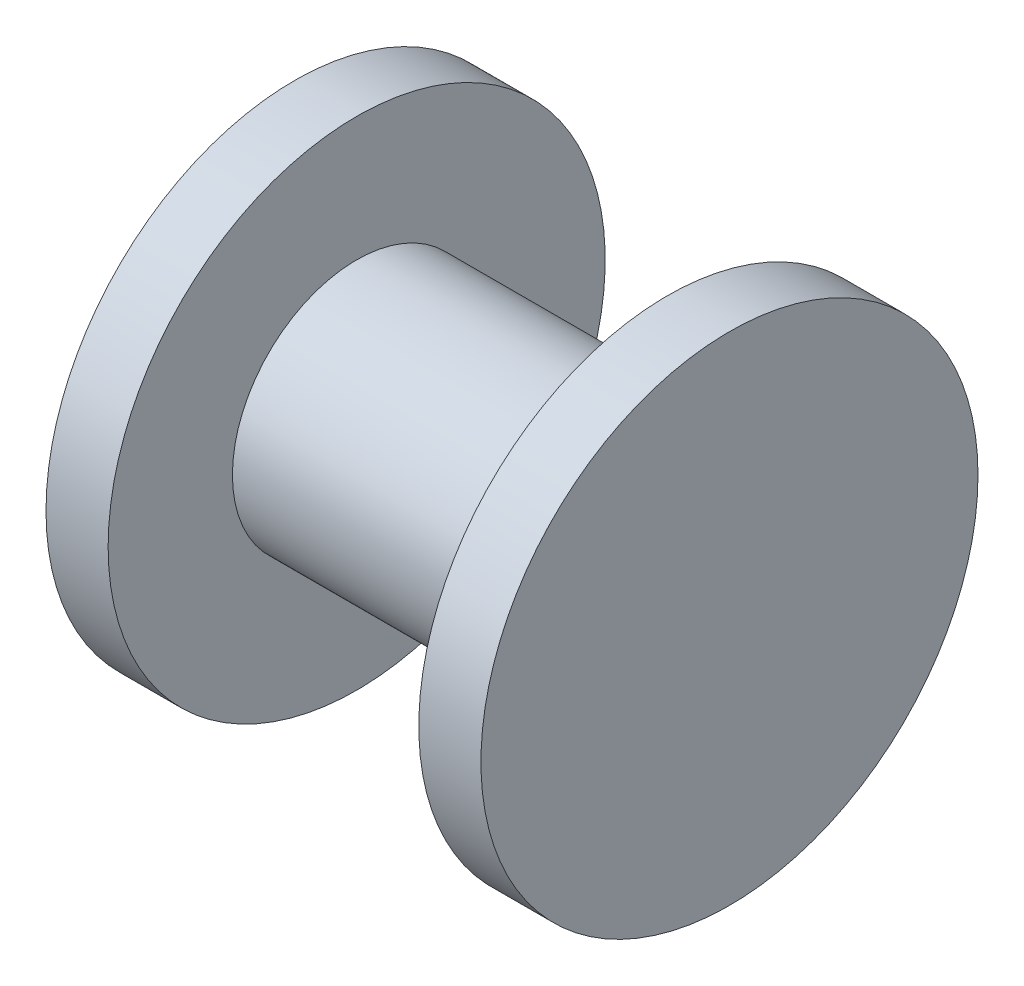
from build123d import *

# Parameters (mm, degrees)
SKETCH1_W           = 25
SKETCH1_H           = 10
SKETCH2_R           = 20
BOSS_EXTRUDE1_DEPTH = 5
BOSS_EXTRUDE2_START = 5
SKETCH3_R           = 20
BOSS_EXTRUDE2_DEPTH = 5


with BuildPart() as part:
    # Sketch1 → Revolve1 (revolve)
    with BuildSketch(Plane.XY, mode=Mode.PRIVATE) as revolve1_sk:
        with Locations((0, 5)):
            Rectangle(SKETCH1_W, SKETCH1_H)
    revolve(revolve1_sk.sketch.rotate(Axis((0, 0, 0), (1, 0, 0)), 90), axis=Axis((0, 0, 0), (1, 0, 0)))

    # Sketch2 → Boss-Extrude1 (add)
    with BuildSketch(Plane.ZY.offset(12.5)):
        Circle(SKETCH2_R)
    extrude(amount=BOSS_EXTRUDE1_DEPTH)

    # Sketch3 → Boss-Extrude2 (add)
    with BuildSketch(Plane(origin=(12.5, 0, 0), x_dir=(0, 0, -1), z_dir=(1, 0, 0)).offset(BOSS_EXTRUDE2_START)):
        with Locations(Location((0, 0, 0), (0, 0, 180))):
            Circle(SKETCH3_R)
    extrude(amount=-BOSS_EXTRUDE2_DEPTH)


solid = part.part
